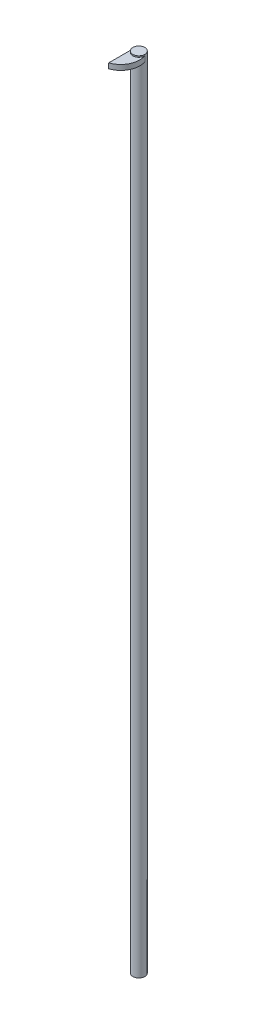
from build123d import *

# Parameters (mm, degrees)
BOSS_EXTRUDE1_DEPTH      = 950
BOSS_EXTRUDE1_DEPTH_BACK = 286
SKETCH1_R                = 9.313662058
BOSS_EXTRUDE2_DEPTH      = 3
BOSS_EXTRUDE2_DEPTH_BACK = 5
BOSS_EXTRUDE2_START      = -5


with BuildPart() as part:
    # Sketch1 → Boss-Extrude1 (new, two sides: drawn at the far end of the back side and taken through both)
    with BuildSketch(Plane(origin=(0, 4239.077255807, 0), x_dir=(1, 0, 0), z_dir=(0, 1, 0)).offset(-BOSS_EXTRUDE1_DEPTH_BACK)):
        with Locations(Location((838.898443774, -1523.820122511, 0), (0, 0, 270))):
            Circle(SKETCH1_R)
    extrude(amount=BOSS_EXTRUDE1_DEPTH + BOSS_EXTRUDE1_DEPTH_BACK)

    # Sketch2 → Boss-Extrude2 (add, two sides: drawn at the far end of the back side and taken through both)
    with BuildSketch(Plane(origin=(0, 5189.077255807, 0), x_dir=(1, 0, 0), z_dir=(0, 1, 0)).offset(BOSS_EXTRUDE2_START - BOSS_EXTRUDE2_DEPTH_BACK)):
        with BuildLine():
            Line((829.584781716, -1561.145044768), (829.584781716, -1523.820122511))
            Line((829.584781716, -1523.820122511), (848.212105832, -1523.820122511))
            ThreePointArc((848.212105832, -1523.820122511), (846.628688281, -1546.340428779), (829.584781716, -1561.145044768))
        make_face()
    extrude(amount=BOSS_EXTRUDE2_DEPTH + BOSS_EXTRUDE2_DEPTH_BACK)


solid = part.part
